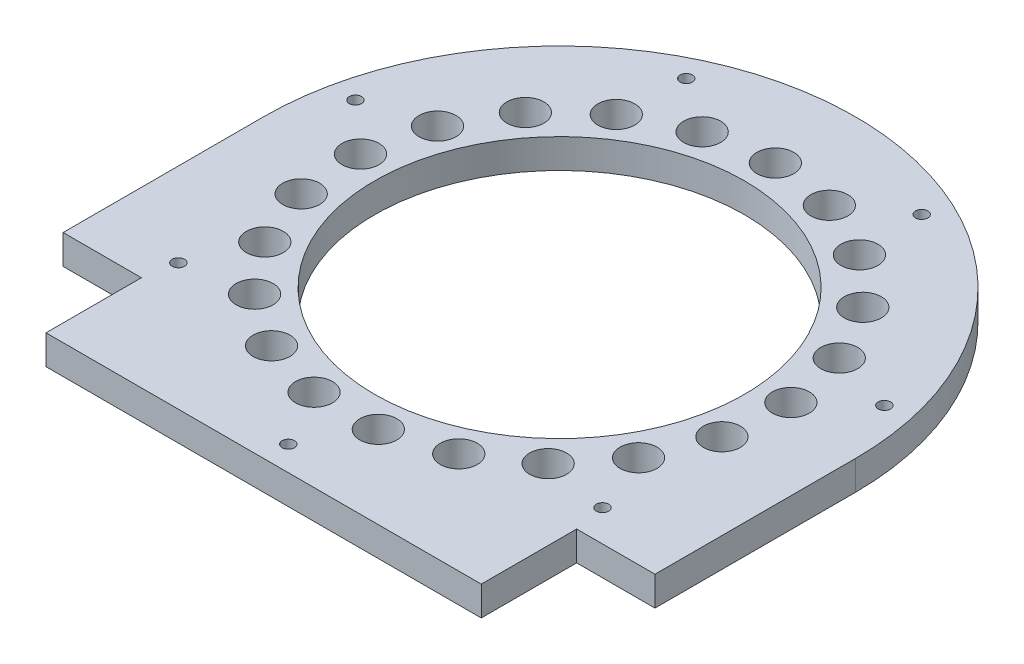
from build123d import *

# Parameters (mm, degrees)
SKETCH2_R           = 30
SKETCH2_R_2         = 3
SKETCH2_R_3         = 1
BOSS_EXTRUDE2_DEPTH = 4.7625


with BuildPart() as part:
    # Sketch2 → Boss-Extrude2 (new body)
    with BuildSketch(Plane(origin=(0, 0, 0), x_dir=(1, 0, 0), z_dir=(0, 1, 0))):
        with BuildLine():
            Line((-48, 0), (-48, -32.525528435))
            Line((-48, -32.525528435), (-35.3, -32.525528435))
            Line((-35.3, -32.525528435), (-35.3, -48))
            Line((-35.3, -48), (35.3, -48))
            Line((35.3, -48), (35.3, -32.525528435))
            Line((35.3, -32.525528435), (48, -32.525528435))
            Line((48, -32.525528435), (48, 0))
            ThreePointArc((48, 0), (0, 48), (-48, 0))
        make_face()
        Circle(SKETCH2_R, mode=Mode.SUBTRACT)
        with Locations((-34.902132901, 2.615553276)):
            Circle(SKETCH2_R_2, mode=Mode.SUBTRACT)
        with Locations((0, 35)):
            Circle(SKETCH2_R_2, mode=Mode.SUBTRACT)
        with Locations((-42.896828136, 9.790921094)):
            Circle(SKETCH2_R_3, mode=Mode.SUBTRACT)
        with Locations((-32.580581203, 12.786935853)):
            Circle(SKETCH2_R_2, mode=Mode.SUBTRACT)
        with Locations((-27.364101886, 21.822143065)):
            Circle(SKETCH2_R_2, mode=Mode.SUBTRACT)
        with Locations((-19.716202032, 28.918357101)):
            Circle(SKETCH2_R_2, mode=Mode.SUBTRACT)
        with Locations((-10.316431104, 33.445048203)):
            Circle(SKETCH2_R_2, mode=Mode.SUBTRACT)
        with Locations((-19.090884521, 39.642630188)):
            Circle(SKETCH2_R_3, mode=Mode.SUBTRACT)
        with Locations((34.902132901, 2.615553276)):
            Circle(SKETCH2_R_2, mode=Mode.SUBTRACT)
        with Locations((30.310889132, -17.5)):
            Circle(SKETCH2_R_2, mode=Mode.SUBTRACT)
        with Locations((34.122476926, -7.788232688)):
            Circle(SKETCH2_R_2, mode=Mode.SUBTRACT)
        with Locations((-34.400585229, -27.433551282)):
            Circle(SKETCH2_R_3, mode=Mode.SUBTRACT)
        with Locations((-15.185930869, -31.533910377)):
            Circle(SKETCH2_R_2, mode=Mode.SUBTRACT)
        with Locations((-23.806045822, -25.656815514)):
            Circle(SKETCH2_R_2, mode=Mode.SUBTRACT)
        with Locations((-5.216479316, -34.609078918)):
            Circle(SKETCH2_R_2, mode=Mode.SUBTRACT)
        with Locations((-30.310889132, -17.5)):
            Circle(SKETCH2_R_2, mode=Mode.SUBTRACT)
        with Locations((-34.122476926, -7.788232688)):
            Circle(SKETCH2_R_2, mode=Mode.SUBTRACT)
        with Locations((0, -44)):
            Circle(SKETCH2_R_3, mode=Mode.SUBTRACT)
        with Locations((5.216479316, -34.609078918)):
            Circle(SKETCH2_R_2, mode=Mode.SUBTRACT)
        with Locations((15.185930869, -31.533910377)):
            Circle(SKETCH2_R_2, mode=Mode.SUBTRACT)
        with Locations((23.806045822, -25.656815514)):
            Circle(SKETCH2_R_2, mode=Mode.SUBTRACT)
        with Locations((34.400585229, -27.433551282)):
            Circle(SKETCH2_R_3, mode=Mode.SUBTRACT)
        with Locations((19.716202032, 28.918357101)):
            Circle(SKETCH2_R_2, mode=Mode.SUBTRACT)
        with Locations((19.090884521, 39.642630188)):
            Circle(SKETCH2_R_3, mode=Mode.SUBTRACT)
        with Locations((27.364101886, 21.822143065)):
            Circle(SKETCH2_R_2, mode=Mode.SUBTRACT)
        with Locations((10.316431104, 33.445048203)):
            Circle(SKETCH2_R_2, mode=Mode.SUBTRACT)
        with Locations((42.896828136, 9.790921094)):
            Circle(SKETCH2_R_3, mode=Mode.SUBTRACT)
        with Locations((32.580581203, 12.786935853)):
            Circle(SKETCH2_R_2, mode=Mode.SUBTRACT)
    extrude(amount=BOSS_EXTRUDE2_DEPTH)


solid = part.part
